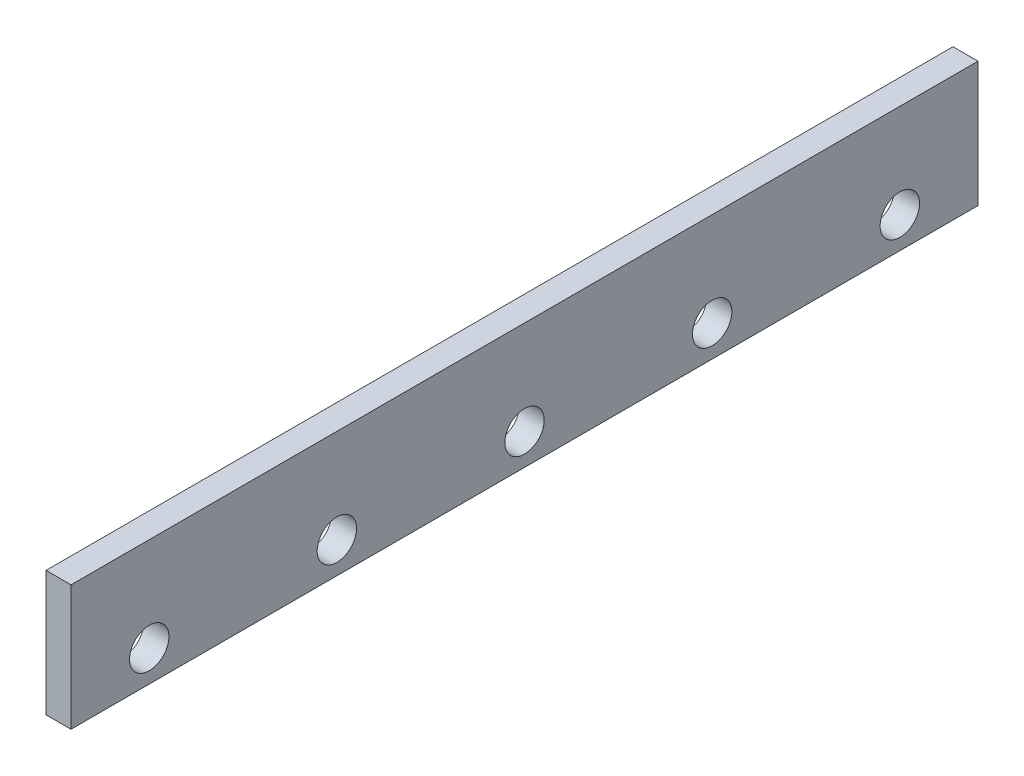
from build123d import *

# Parameters (mm, degrees)
CROQUIS1_W              = 580
CROQUIS1_H              = 80
SALIENTE_EXTRUIR1_DEPTH = 16
CROQUIS2_R              = 12.6
CORTAR_EXTRUIR1_DEPTH   = 294.182536997


with BuildPart() as part:
    # Croquis1 → Saliente-Extruir1 (new body)
    with BuildSketch(Plane(origin=(0, 0, 0), x_dir=(0, 0, -1), z_dir=(1, 0, 0))):
        Rectangle(CROQUIS1_W, CROQUIS1_H)
    extrude(amount=-SALIENTE_EXTRUIR1_DEPTH)

    # Croquis2 → Cortar-Extruir1 (cut, through all)
    with BuildSketch(Plane(origin=(0, 0, 0), x_dir=(0, 0, -1), z_dir=(1, 0, 0))):
        with Locations((-240, -20)):
            Circle(CROQUIS2_R)
        with Locations((-120, -20)):
            Circle(CROQUIS2_R)
        with Locations((0, -20)):
            Circle(CROQUIS2_R)
        with Locations((120, -20)):
            Circle(CROQUIS2_R)
        with Locations((240, -20)):
            Circle(CROQUIS2_R)
    extrude(amount=-CORTAR_EXTRUIR1_DEPTH, mode=Mode.SUBTRACT)


solid = part.part
